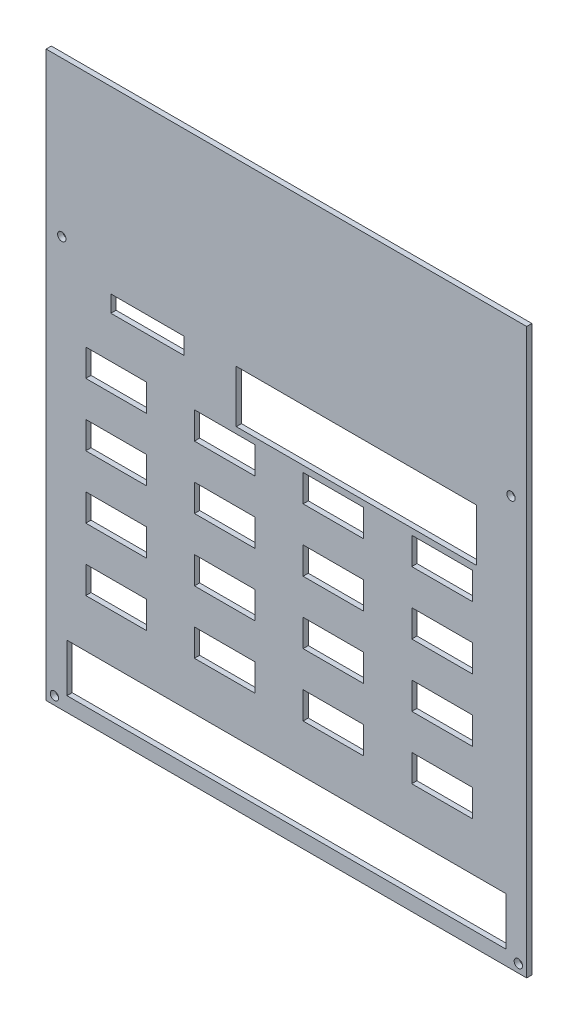
from build123d import *

# Parameters (mm, degrees)
ESQUISSE1_W             = 230
ESQUISSE1_H             = 270
BOSS_EXTRU_2_DEPTH      = 2.5
ENL_V_MAT_EXTRU_1_REACH = 405.102
ESQUISSE4_W             = 210
ESQUISSE4_H             = 23
ESQUISSE5_R             = 2
ENL_V_MAT_EXTRU_2_DEPTH = 2.5
ESQUISSE6_W             = 35
ESQUISSE6_H             = 8
ESQUISSE6_W_2           = 115
ESQUISSE6_H_2           = 25
ENL_V_MAT_EXTRU_3_DEPTH = 2.5
ESQUISSE7_W             = 29
ESQUISSE7_H             = 13
ENL_V_MAT_EXTRU_4_DEPTH = 2.5
ESQUISSE8_W             = 160
ESQUISSE8_H             = 2.5
BOSS_EXTRU_3_DEPTH      = 8
ESQUISSE9_R             = 2
ENL_V_MAT_EXTRU_5_DEPTH = 404.231037827
ESQUISSE11_R            = 2
ENL_V_MAT_EXTRU_6_DEPTH = 404.231037827


with BuildPart() as part:
    # Esquisse1 → Boss.-Extru.2 (new body)
    with BuildSketch(Plane.XY.offset(25)):
        with Locations((-102.459507472, 204.405925813)):
            Rectangle(ESQUISSE1_W, ESQUISSE1_H)
    extrude(amount=BOSS_EXTRU_2_DEPTH)

    # Esquisse4 → Enlèv. mat.-Extru.1 (cut, up to next)
    with BuildSketch(Plane.XY.offset(27.5), mode=Mode.PRIVATE) as enl_v_mat_extru_1_sk1:
        with Locations((-102.459507472, 87.905925813)):
            Rectangle(ESQUISSE4_W, ESQUISSE4_H)
    enl_v_mat_extru_1_tool1 = extrude(enl_v_mat_extru_1_sk1.sketch, amount=-ENL_V_MAT_EXTRU_1_REACH, mode=Mode.PRIVATE) & part.part
    add(enl_v_mat_extru_1_tool1.solids().sort_by_distance((-102.459507, 87.905926, 27.5))[0], mode=Mode.SUBTRACT)

    # Esquisse5 → Enlèv. mat.-Extru.2 (cut)
    with BuildSketch(Plane.XY.offset(27.5)):
        with Locations((-213.459507472, 73.405925813)):
            Circle(ESQUISSE5_R)
        with Locations((8.540492528, 73.405925813)):
            Circle(ESQUISSE5_R)
    extrude(amount=-ENL_V_MAT_EXTRU_2_DEPTH, mode=Mode.SUBTRACT)

    # Esquisse6 → Enlèv. mat.-Extru.3 (cut)
    with BuildSketch(Plane.XY.offset(27.5)):
        with Locations((-168.959507472, 249.405925813)):
            Rectangle(ESQUISSE6_W, ESQUISSE6_H)
        with Locations((-68.959507472, 240.905925813)):
            Rectangle(ESQUISSE6_W_2, ESQUISSE6_H_2)
    extrude(amount=-ENL_V_MAT_EXTRU_3_DEPTH, mode=Mode.SUBTRACT)

    # Esquisse7 → Enlèv. mat.-Extru.4 (cut)
    with BuildSketch(Plane.XY.offset(27.5)):
        with Locations((-131.959507472, 218.905925813)):
            Rectangle(ESQUISSE7_W, ESQUISSE7_H)
        with Locations((-183.959507472, 218.905925813)):
            Rectangle(ESQUISSE7_W, ESQUISSE7_H)
        with Locations((-79.959507472, 218.905925813)):
            Rectangle(ESQUISSE7_W, ESQUISSE7_H)
        with Locations((-27.959507472, 218.905925813)):
            Rectangle(ESQUISSE7_W, ESQUISSE7_H)
        with Locations((-131.959507472, 188.905925813)):
            Rectangle(ESQUISSE7_W, ESQUISSE7_H)
        with Locations((-79.959507472, 188.905925813)):
            Rectangle(ESQUISSE7_W, ESQUISSE7_H)
        with Locations((-27.959507472, 188.905925813)):
            Rectangle(ESQUISSE7_W, ESQUISSE7_H)
        with Locations((-131.959507472, 158.905925813)):
            Rectangle(ESQUISSE7_W, ESQUISSE7_H)
        with Locations((-79.959507472, 158.905925813)):
            Rectangle(ESQUISSE7_W, ESQUISSE7_H)
        with Locations((-27.959507472, 158.905925813)):
            Rectangle(ESQUISSE7_W, ESQUISSE7_H)
        with Locations((-131.959507472, 128.905925813)):
            Rectangle(ESQUISSE7_W, ESQUISSE7_H)
        with Locations((-79.959507472, 128.905925813)):
            Rectangle(ESQUISSE7_W, ESQUISSE7_H)
        with Locations((-27.959507472, 128.905925813)):
            Rectangle(ESQUISSE7_W, ESQUISSE7_H)
        with Locations((-183.959507472, 188.905925813)):
            Rectangle(ESQUISSE7_W, ESQUISSE7_H)
        with Locations((-183.959507472, 158.905925813)):
            Rectangle(ESQUISSE7_W, ESQUISSE7_H)
        with Locations((-183.959507472, 128.905925813)):
            Rectangle(ESQUISSE7_W, ESQUISSE7_H)
    extrude(amount=-ENL_V_MAT_EXTRU_4_DEPTH, mode=Mode.SUBTRACT)

    # Esquisse8 → Boss.-Extru.3 (add)
    with BuildSketch(Plane(origin=(0, 0, 25), x_dir=(-1, 0, 0), z_dir=(0, 0, -1))):
        with Locations((114.330010258, 199.655925813)):
            Rectangle(ESQUISSE8_W, ESQUISSE8_H)
    extrude(amount=BOSS_EXTRU_3_DEPTH)

    # Esquisse9 → Enlèv. mat.-Extru.5 (cut, through all)
    with BuildSketch(Plane.XY.offset(27.5)):
        with Locations((-209.959507472, 265.405925813)):
            Circle(ESQUISSE9_R)
    extrude(amount=-ENL_V_MAT_EXTRU_5_DEPTH, mode=Mode.SUBTRACT)

    # Esquisse11 → Enlèv. mat.-Extru.6 (cut, through all)
    with BuildSketch(Plane.XY.offset(27.5)):
        with Locations((5.040492528, 265.405925813)):
            Circle(ESQUISSE11_R)
    extrude(amount=-ENL_V_MAT_EXTRU_6_DEPTH, mode=Mode.SUBTRACT)


solid = part.part
